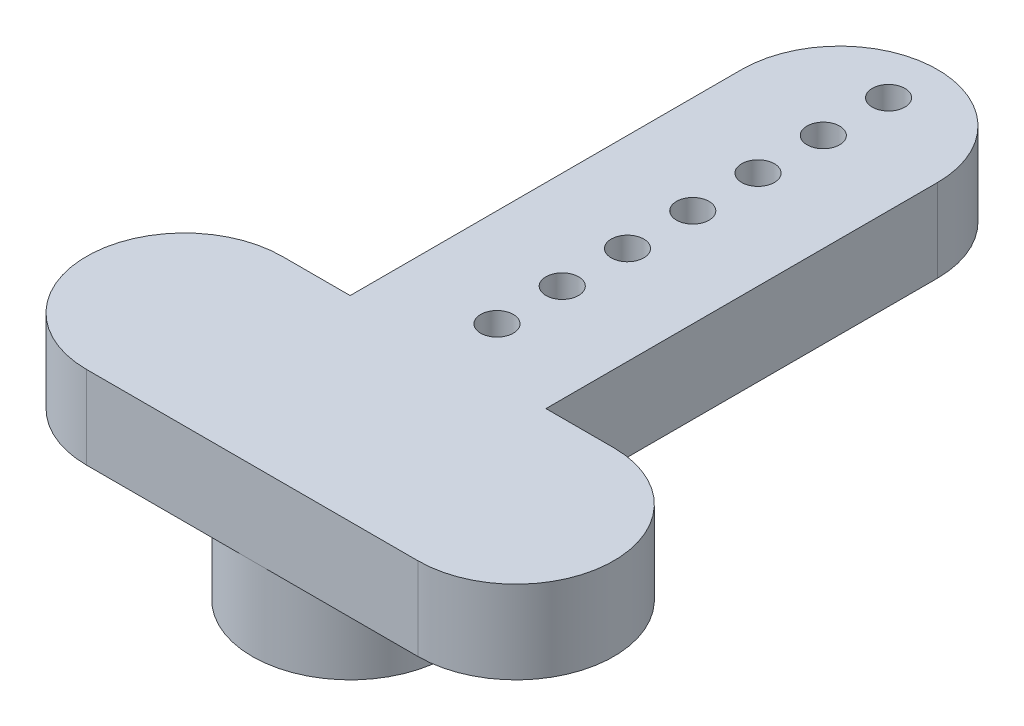
from build123d import *

# Parameters (mm, degrees)
SKETCH1_R           = 3
BOSS_EXTRUDE1_DEPTH = 2.54
SKETCH2_R           = 3
BOSS_EXTRUDE2_DEPTH = 2.54
SKETCH3_R           = 0.5
CUT_EXTRUDE1_DEPTH  = 10


with BuildPart() as part:
    # Sketch1 → Boss-Extrude1 (new body)
    with BuildSketch(Plane(origin=(0, 0, 0), x_dir=(1, 0, 0), z_dir=(0, 1, 0))):
        with Locations(Location((0, 0, 0), (0, 0, 270))):
            Circle(SKETCH1_R)
    extrude(amount=BOSS_EXTRUDE1_DEPTH)

    # Sketch2 → Boss-Extrude2 (add)
    with BuildSketch(Plane(origin=(0, 2.54, 0), x_dir=(1, 0, 0), z_dir=(0, 1, 0))):
        with BuildLine():
            ThreePointArc((-3, 15), (0, 18), (3, 15))
            Line((3, 15), (-3, 15))
        make_face()
        Polygon((-3, 15), (-3, 3), (0, 3), (3, 3), (3, 15), align=None)
        with BuildLine():
            Line((-5.08, 3), (-5.08, -3))
            ThreePointArc((-5.08, -3), (-8.08, 0), (-5.08, 3))
        make_face()
        Polygon((-3, 3), (-5.08, 3), (-5.08, -3), (-3, -3), (-3, 6e-09), align=None)
        with BuildLine():
            Line((3, 3), (0, 3))
            ThreePointArc((0, 3), (2.121320344, 2.121320344), (3, 0))
            Line((3, 0), (3, 3))
        make_face()
        with Locations(Location((0, 0, 0), (0, 0, 270))):
            Circle(SKETCH2_R)
        with BuildLine():
            Line((3, -3), (3, 0))
            ThreePointArc((3, 0), (2.121320338, -2.121320349), (-1.5e-08, -3))
            Line((-1.5e-08, -3), (3, -3))
        make_face()
        with BuildLine():
            ThreePointArc((5.08, 3), (8.08, 0), (5.08, -3))
            Line((5.08, -3), (5.08, 3))
        make_face()
        Polygon((5.08, 3), (3, 3), (3, 0), (3, -3), (5.08, -3), align=None)
        with BuildLine():
            ThreePointArc((-1.5e-08, -3), (-2.121320351, -2.121320336), (-3, 6e-09))
            Line((-3, 6e-09), (-3, -3))
            Line((-3, -3), (-1.5e-08, -3))
        make_face()
        with BuildLine():
            Line((0, 3), (-3, 3))
            Line((-3, 3), (-3, 6e-09))
            ThreePointArc((-3, 6e-09), (-2.121320342, 2.121320346), (0, 3))
        make_face()
    extrude(amount=BOSS_EXTRUDE2_DEPTH)

    # Sketch3 → Cut-Extrude1 (cut)
    with BuildSketch(Plane(origin=(0, 5.08, 0), x_dir=(1, 0, 0), z_dir=(0, 1, 0))):
        with Locations(Location((0, 16.5, 0), (0, 0, 270))):
            Circle(SKETCH3_R)
        with Locations(Location((0, 14.5, 0), (0, 0, 270))):
            Circle(SKETCH3_R)
        with Locations(Location((0, 12.5, 0), (0, 0, 270))):
            Circle(SKETCH3_R)
        with Locations(Location((0, 10.5, 0), (0, 0, 270))):
            Circle(SKETCH3_R)
        with Locations(Location((0, 8.5, 0), (0, 0, 270))):
            Circle(SKETCH3_R)
        with Locations(Location((0, 6.5, 0), (0, 0, 270))):
            Circle(SKETCH3_R)
        with Locations(Location((0, 4.5, 0), (0, 0, 270))):
            Circle(SKETCH3_R)
    extrude(amount=-CUT_EXTRUDE1_DEPTH, mode=Mode.SUBTRACT)


solid = part.part
